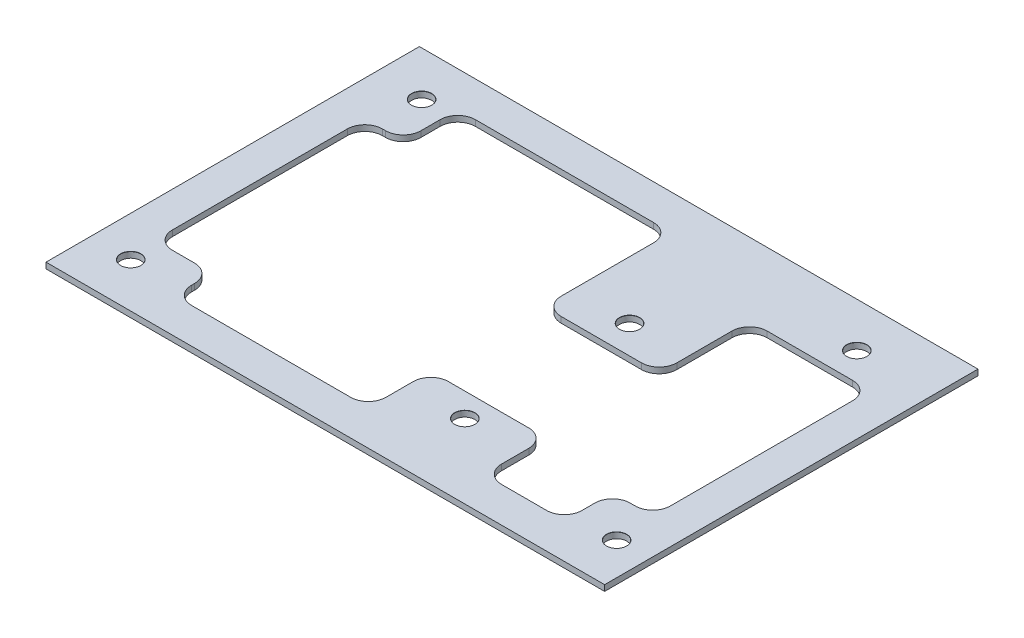
from build123d import *

# Parameters (mm, degrees)
SKETCH2_W                     = 95
SKETCH2_H                     = 63.5
BOSS_EXTRUDE1_DEPTH           = 1
M3_CLEARANCE_HOLE1_AT_2_COUNT = 2
M3_CLEARANCE_HOLE1_AT_2_PITCH = 48.353205685
M3_CLEARANCE_HOLE1_AT_3_COUNT = 2
M3_CLEARANCE_HOLE1_AT_3_PITCH = 74
M3_CLEARANCE_HOLE1_AT_4_COUNT = 2
M3_CLEARANCE_HOLE1_AT_4_PITCH = 94.757614997
M3_CLEARANCE_HOLE1_AT_5_COUNT = 2
M3_CLEARANCE_HOLE1_AT_5_PITCH = 66.684465957
M3_CLEARANCE_HOLE1_AT_6_COUNT = 2
M3_CLEARANCE_HOLE1_AT_6_PITCH = 52.944922325
CUT_EXTRUDE1_DEPTH            = 1


with BuildPart() as part:
    # Sketch2 → Boss-Extrude1 (new body)
    with BuildSketch(Plane(origin=(0, 0, 0), x_dir=(1, 0, 0), z_dir=(0, 1, 0))):
        Rectangle(SKETCH2_W, SKETCH2_H)
    extrude(amount=BOSS_EXTRUDE1_DEPTH)

    # Sketch8 → M3 Clearance Hole1 (revolve, cut)
    with BuildSketch(Plane(origin=(-39.536732268, 1, -24.17), x_dir=(0, 0, 1), z_dir=(1, 0, 0))):
        Polygon((0, 0), (0, 1), (1.7, 1), (1.7, 0.025), (1.725, 0), align=None)
    m3_clearance_hole1 = revolve(axis=Axis((-39.536732268, 7.35, -24.17), (0, -1, 0)), mode=Mode.SUBTRACT)

    # M3 Clearance Hole1 at 2: M3 Clearance Hole1 ×2
    with Locations(*[Vector(-0.023369701842837577, 0, 0.9997268912236866) * (i * M3_CLEARANCE_HOLE1_AT_2_PITCH) for i in range(1, M3_CLEARANCE_HOLE1_AT_2_COUNT)]):
        add(m3_clearance_hole1, mode=Mode.SUBTRACT)

    # M3 Clearance Hole1 at 3: M3 Clearance Hole1 ×2
    with Locations(*[(i * M3_CLEARANCE_HOLE1_AT_3_PITCH, 0, 0) for i in range(1, M3_CLEARANCE_HOLE1_AT_3_COUNT)]):
        add(m3_clearance_hole1, mode=Mode.SUBTRACT)

    # M3 Clearance Hole1 at 4: M3 Clearance Hole1 ×2
    with Locations(*[Vector(0.8600891865230647, 0, 0.5101436966444779) * (i * M3_CLEARANCE_HOLE1_AT_4_PITCH) for i in range(1, M3_CLEARANCE_HOLE1_AT_4_COUNT)]):
        add(m3_clearance_hole1, mode=Mode.SUBTRACT)

    # M3 Clearance Hole1 at 5: M3 Clearance Hole1 ×2
    with Locations(*[Vector(0.7599970888649028, 0, 0.6499264765470578) * (i * M3_CLEARANCE_HOLE1_AT_5_PITCH) for i in range(1, M3_CLEARANCE_HOLE1_AT_5_COUNT)]):
        add(m3_clearance_hole1, mode=Mode.SUBTRACT)

    # M3 Clearance Hole1 at 6: M3 Clearance Hole1 ×2
    with Locations(*[Vector(0.957221160679124, 0, 0.28935730429368944) * (i * M3_CLEARANCE_HOLE1_AT_6_PITCH) for i in range(1, M3_CLEARANCE_HOLE1_AT_6_COUNT)]):
        add(m3_clearance_hole1, mode=Mode.SUBTRACT)

    # Sketch9 → Cut-Extrude1 (cut)
    with BuildSketch(Plane(origin=(0, 1, 0), x_dir=(1, 0, 0), z_dir=(0, 1, 0))):
        with BuildLine():
            Line((-34.974163292, 19.487383717), (-34.974163292, 22.75))
            ThreePointArc((-34.974163292, 22.75), (-34.095483636, 24.871320344), (-31.974163292, 25.75))
            Line((-31.974163292, 25.75), (-1.684765082, 25.75))
            ThreePointArc((-1.684765082, 25.75), (0.436555262, 24.871320344), (1.315234918, 22.75))
            Line((1.315234918, 22.75), (1.315234918, 7.055031971))
            ThreePointArc((1.315234918, 7.055031971), (2.193914574, 4.933711628), (4.315234918, 4.055031971))
            Line((4.315234918, 4.055031971), (17.971300546, 4.055031971))
            ThreePointArc((17.971300546, 4.055031971), (20.09262089, 4.933711628), (20.971300546, 7.055031971))
            Line((20.971300546, 7.055031971), (20.971300546, 16.428287462))
            ThreePointArc((20.971300546, 16.428287462), (21.849980203, 18.549607805), (23.971300546, 19.428287462))
            Line((23.971300546, 19.428287462), (38.5, 19.428287462))
            ThreePointArc((38.5, 19.428287462), (40.621320344, 18.549607805), (41.5, 16.428287462))
            Line((41.5, 16.428287462), (41.5, -14.560508757))
            ThreePointArc((41.5, -14.560508757), (40.621320344, -16.681829101), (38.5, -17.560508757))
            Line((38.5, -17.560508757), (37.647901029, -17.560508757))
            ThreePointArc((37.647901029, -17.560508757), (35.526580685, -18.439188414), (34.647901029, -20.560508757))
            Line((34.647901029, -20.560508757), (34.647901029, -22.75))
            ThreePointArc((34.647901029, -22.75), (33.769221372, -24.871320344), (31.647901029, -25.75))
            Line((31.647901029, -25.75), (23.971300546, -25.75))
            ThreePointArc((23.971300546, -25.75), (21.849980203, -24.871320344), (20.971300546, -22.75))
            Line((20.971300546, -22.75), (20.971300546, -18.118028913))
            ThreePointArc((20.971300546, -18.118028913), (20.09262089, -15.996708569), (17.971300546, -15.118028913))
            Line((17.971300546, -15.118028913), (4.315234918, -15.118028913))
            ThreePointArc((4.315234918, -15.118028913), (2.193914574, -15.996708569), (1.315234918, -18.118028913))
            Line((1.315234918, -18.118028913), (1.315234918, -22.75))
            ThreePointArc((1.315234918, -22.75), (0.436555262, -24.871320344), (-1.684765082, -25.75))
            Line((-1.684765082, -25.75), (-28.730080623, -25.75))
            ThreePointArc((-28.730080623, -25.75), (-30.851400966, -24.871320344), (-31.730080623, -22.75))
            Line((-31.730080623, -22.75), (-31.730080623, -22.252488185))
            ThreePointArc((-31.730080623, -22.252488185), (-32.608760279, -20.131167841), (-34.730080623, -19.252488185))
            Line((-34.730080623, -19.252488185), (-38.5, -19.252488185))
            ThreePointArc((-38.5, -19.252488185), (-40.621320344, -18.373808528), (-41.5, -16.252488185))
            Line((-41.5, -16.252488185), (-41.5, 13.487383717))
            ThreePointArc((-41.5, 13.487383717), (-40.621320344, 15.60870406), (-38.5, 16.487383717))
            Line((-38.5, 16.487383717), (-37.974163292, 16.487383717))
            ThreePointArc((-37.974163292, 16.487383717), (-35.852842949, 17.366063373), (-34.974163292, 19.487383717))
        make_face()
    extrude(amount=-CUT_EXTRUDE1_DEPTH, mode=Mode.SUBTRACT)


solid = part.part
